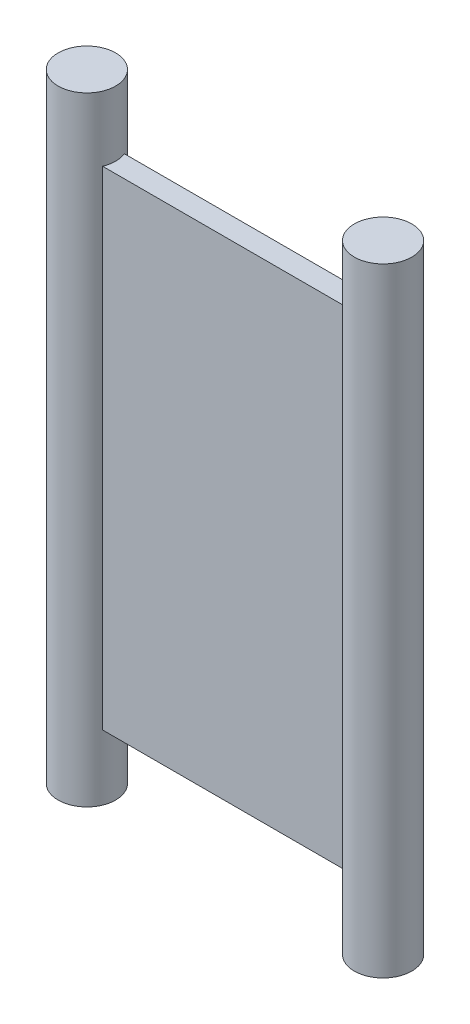
from build123d import *

# Parameters (mm, degrees)
SKETCH1_W           = 13.652
SKETCH1_H           = 1
BOSS_EXTRUDE1_DEPTH = 22.5
SKETCH2_R           = 1.325
BOSS_EXTRUDE2_DEPTH = 14.25


with BuildPart() as part:
    # Sketch1 → Boss-Extrude1 (new body)
    with BuildSketch(Plane(origin=(0, 0, 0), x_dir=(1, 0, 0), z_dir=(0, 1, 0))):
        Rectangle(SKETCH1_W, SKETCH1_H)
    extrude(amount=BOSS_EXTRUDE1_DEPTH)

    # Sketch2 → Boss-Extrude2 (add, symmetric)
    with BuildSketch(Plane(origin=(0, 11.25, 0), x_dir=(1, 0, 0), z_dir=(0, 1, 0))):
        with Locations(Location((-6.826, 0, 0), (0, 0, 270))):
            Circle(SKETCH2_R)
        with Locations(Location((6.826, 0, 0), (0, 0, 270))):
            Circle(SKETCH2_R)
    extrude(amount=BOSS_EXTRUDE2_DEPTH, both=True)


solid = part.part
